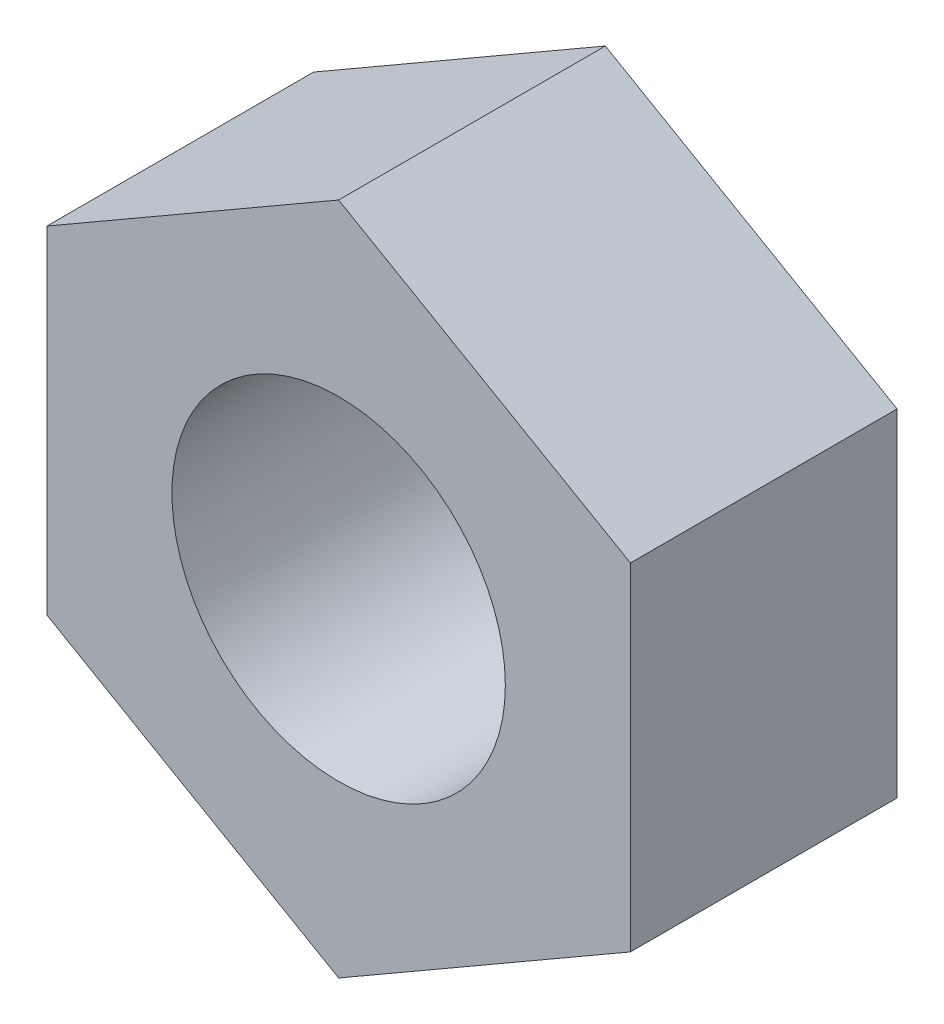
from build123d import *

# Parameters (mm, degrees)
SKETCH1_R           = 1.5
BOSS_EXTRUDE1_DEPTH = 2.4


with BuildPart() as part:
    # Sketch1 → Boss-Extrude1 (new body)
    with BuildSketch(Plane(origin=(0, 0, 0), x_dir=(0, 1, 0), z_dir=(0, 0, 1))):
        Polygon((3.031088913, 0), (1.515544457, 2.625), (-1.515544457, 2.625), (-3.031088913, 0), (-1.515544457, -2.625), (1.515544457, -2.625), align=None)
        with Locations(Location((0, 0, 0), (0, 0, 270))):
            Circle(SKETCH1_R, mode=Mode.SUBTRACT)
    extrude(amount=BOSS_EXTRUDE1_DEPTH)


solid = part.part
